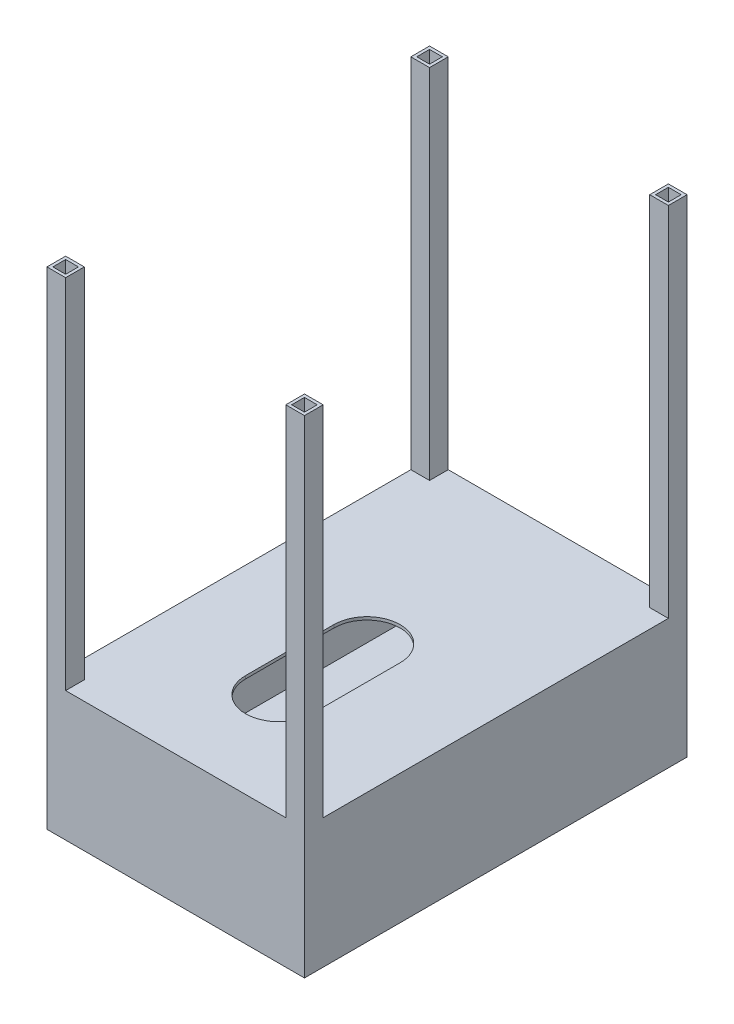
from build123d import *

# Parameters (mm, degrees)
SKETCH1_W                 = 175
SKETCH1_H                 = 260
BOSS_EXTRUDE1_DEPTH       = 3
SKETCH3_W                 = 12.7
SKETCH3_H                 = 12.7
SKETCH3_W_2               = 8.7
SKETCH3_H_2               = 8.7
EXTRUDE_THIN1_DEPTH       = 328
MIRROR2_COPY_1_SKETCH_W   = 12.7
MIRROR2_COPY_1_SKETCH_H   = 12.7
MIRROR2_COPY_1_SKETCH_W_2 = 8.7
MIRROR2_COPY_1_SKETCH_H_2 = 8.7
MIRROR2_COPY_1_DEPTH      = 328
SKETCH5_W                 = 175
SKETCH5_H                 = 260
SKETCH5_W_2               = 171
SKETCH5_H_2               = 256
EXTRUDE_THIN2_DEPTH       = 83
SKETCH6_W                 = 175
SKETCH6_H                 = 260
BOSS_EXTRUDE2_DEPTH       = 2
SKETCH8_R                 = 22.5
CUT_EXTRUDE1_DEPTH        = 364.51100396
SKETCH9_R                 = 7.5
CUT_EXTRUDE2_DEPTH        = 3


with BuildPart() as part:
    # Sketch1 → Boss-Extrude1 (new body)
    with BuildSketch(Plane(origin=(0, 0, 0), x_dir=(1, 0, 0), z_dir=(0, 1, 0))):
        Rectangle(SKETCH1_W, SKETCH1_H)
    extrude(amount=BOSS_EXTRUDE1_DEPTH)

    # Sketch3 → Extrude-Thin1 (add)
    with BuildSketch(Plane(origin=(0, 3, 0), x_dir=(1, 0, 0), z_dir=(0, 1, 0))):
        with Locations((-81.15, 123.65)):
            Rectangle(SKETCH3_W, SKETCH3_H)
        with Locations((-81.15, 123.65)):
            Rectangle(SKETCH3_W_2, SKETCH3_H_2, mode=Mode.SUBTRACT)
    extrude_thin1 = extrude(amount=EXTRUDE_THIN1_DEPTH)

    # Mirror1: Extrude-Thin1 across plane
    add(extrude_thin1.mirror(Plane(origin=(0, 0, 0), x_dir=(0, 0, 1), z_dir=(1, 0, 0))))

    # Mirror2: Extrude-Thin1 across plane
    add(extrude_thin1.mirror(Plane.XY))

    # Mirror2 copy 1 sketch → Mirror2 copy 1 (add)
    with BuildSketch(Plane(origin=(0, 3, 0), x_dir=(-1, 0, 0), z_dir=(0, 1, 0))):
        with Locations((-81.15, 123.65)):
            Rectangle(MIRROR2_COPY_1_SKETCH_W, MIRROR2_COPY_1_SKETCH_H)
        with Locations((-81.15, 123.65)):
            Rectangle(MIRROR2_COPY_1_SKETCH_W_2, MIRROR2_COPY_1_SKETCH_H_2, mode=Mode.SUBTRACT)
    extrude(amount=MIRROR2_COPY_1_DEPTH)

    # Sketch5 → Extrude-Thin2 (add)
    with BuildSketch(Plane(origin=(0, 3, 0), x_dir=(1, 0, 0), z_dir=(0, 1, 0))):
        Rectangle(SKETCH5_W, SKETCH5_H)
        Rectangle(SKETCH5_W_2, SKETCH5_H_2, mode=Mode.SUBTRACT)
    extrude(amount=EXTRUDE_THIN2_DEPTH)

    # Sketch6 → Boss-Extrude2 (add)
    with BuildSketch(Plane(origin=(0, 86, 0), x_dir=(1, 0, 0), z_dir=(0, 1, 0))):
        Rectangle(SKETCH6_W, SKETCH6_H)
    extrude(amount=BOSS_EXTRUDE2_DEPTH)

    # Sketch8 → Cut-Extrude1 (cut, through all)
    with BuildSketch(Plane(origin=(0, 3, 0), x_dir=(1, 0, 0), z_dir=(0, 1, 0))):
        with Locations((0, -60)):
            Circle(SKETCH8_R)
        with BuildLine():
            ThreePointArc((22.5, 0), (0, -22.5), (-22.5, 0))
            Line((-22.5, 0), (-22.5, -60))
            ThreePointArc((-22.5, -60), (0, -37.5), (22.5, -60))
            Line((22.5, -60), (22.5, 0))
        make_face()
        Circle(SKETCH8_R)
    extrude(amount=CUT_EXTRUDE1_DEPTH, mode=Mode.SUBTRACT)

    # Sketch9 → Cut-Extrude2 (cut)
    with BuildSketch(Plane.XZ):
        with Locations((-15, -112.5)):
            Circle(SKETCH9_R)
        with BuildLine():
            Line((15, -105), (-15, -105))
            ThreePointArc((-15, -105), (-9.696699141, -107.196699141), (-7.5, -112.5))
            ThreePointArc((-7.5, -112.5), (-9.696699141, -117.803300859), (-15, -120))
            Line((-15, -120), (15, -120))
            ThreePointArc((15, -120), (7.5, -112.5), (15, -105))
        make_face()
        with Locations((15, -112.5)):
            Circle(SKETCH9_R)
    extrude(amount=-CUT_EXTRUDE2_DEPTH, mode=Mode.SUBTRACT)


solid = part.part
